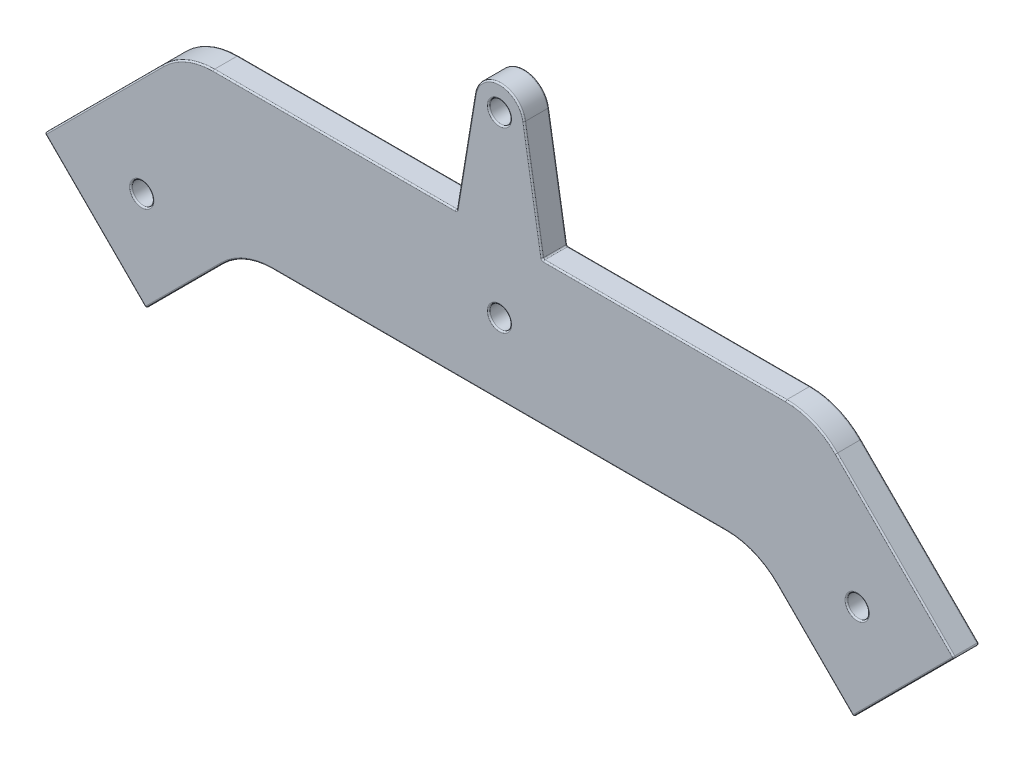
from build123d import *

# Parameters (mm, degrees)
SKETCH6_R           = 1.5
BOSS_EXTRUDE1_DEPTH = 3.5
FILLET1_R           = 10
FILLET2_R           = 0.2


with BuildPart() as part:
    # Sketch6 → Boss-Extrude1 (new body)
    # profile 1 of 2: a face of its own
    with BuildSketch(Plane.XY):
        with BuildLine():
            Line((-6, 70), (6, 70))
            Line((6, 70), (3.453220204, 85.420324662))
            ThreePointArc((3.453220204, 85.420324662), (0, 88.35), (-3.453220204, 85.420324662))
            Line((-3.453220204, 85.420324662), (-6, 70))
        make_face()
        with Locations((0, 84.85)):
            Circle(SKETCH6_R, mode=Mode.SUBTRACT)
    # profile 2 of 2: a face of its own
    with BuildSketch(Plane.XY):
        Polygon((44.142135624, 70), (6, 70), (-6, 70), (-44.142135624, 70), (-63.587572106, 50.554563517), (-49.445436483, 36.412427894), (-35.857864376, 50), (35.857864376, 50), (49.445436483, 36.412427894), (63.587572106, 50.554563517), align=None)
        with Locations((-50, 50)):
            Circle(SKETCH6_R, mode=Mode.SUBTRACT)
        with Locations((0, 60)):
            Circle(SKETCH6_R, mode=Mode.SUBTRACT)
        with Locations((50, 50)):
            Circle(SKETCH6_R, mode=Mode.SUBTRACT)
    extrude(amount=BOSS_EXTRUDE1_DEPTH)

    # Fillet1
    fillet1_edges = [part.edges().sort_by_distance(p)[0] for p in [
        (44.142135624, 70, 1.75),
        (35.857864376, 50, 1.75),
        (-35.857864376, 50, 1.75),
        (-44.142135624, 70, 1.75),
    ]]
    fillet(fillet1_edges, radius=FILLET1_R)

    # Fillet2
    fillet2_edges = [part.edges().sort_by_distance(p)[0] for p in [
        (48.5, 50, 3.5),
        (-1.5, 84.85, 3.5),
        (55.329319959, 58.812815665, 0),
        (56.516504294, 43.483495706, 0),
        (-1.5, 60, 3.5),
        (-44.116116524, 41.741747853, 0),
        (-56.516504294, 43.483495706, 0),
        (-23, 70, 0),
        (-4.726610102, 77.710162331, 0),
        (0, 88.35, 0),
        (4.726610102, 77.710162331, 0),
        (-51.5, 50, 0),
        (-51.5, 50, 3.5),
        (-1.5, 60, 0),
        (-1.5, 84.85, 0),
        (48.5, 50, 0),
        (4.726610102, 77.710162331, 3.5),
        (6, 70, 1.75),
        (63.587572106, 50.554563517, 1.75),
        (49.445436483, 36.412427894, 1.75),
        (-49.445436483, 36.412427894, 1.75),
        (-63.587572106, 50.554563517, 1.75),
        (-6, 70, 1.75),
        (0, 88.35, 3.5),
        (-4.726610102, 77.710162331, 3.5),
        (-23, 70, 3.5),
        (44.116116524, 41.741747853, 0),
        (44.116116524, 41.741747853, 3.5),
        (0, 50, 0),
        (0, 50, 3.5),
        (-56.516504294, 43.483495706, 3.5),
        (23, 70, 0),
        (23, 70, 3.5),
        (-55.329319959, 58.812815665, 0),
        (-43.826834324, 69.238795325, 0),
        (43.826834324, 69.238795325, 0),
        (-44.116116524, 41.741747853, 3.5),
        (-55.329319959, 58.812815665, 3.5),
        (-43.826834324, 69.238795325, 3.5),
        (43.826834324, 69.238795325, 3.5),
        (35.542563076, 49.238795325, 0),
        (35.542563076, 49.238795325, 3.5),
        (-35.542563076, 49.238795325, 0),
        (-35.542563076, 49.238795325, 3.5),
        (56.516504294, 43.483495706, 3.5),
        (55.329319959, 58.812815665, 3.5),
    ]]
    fillet(fillet2_edges, radius=FILLET2_R)


solid = part.part
